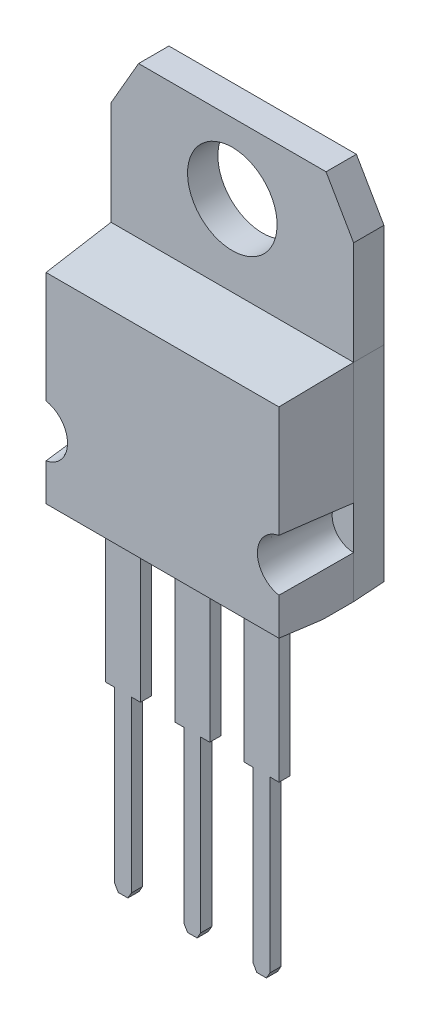
from build123d import *
from OCP.BRepFilletAPI import BRepFilletAPI_MakeChamfer

# Parameters (mm, degrees)
SKIZZE1_W                                 = 10.16
SKIZZE1_H                                 = 8.765
SKIZZE1_H_2                               = 6.335
SKIZZE1_R                                 = 1.875
AUFSATZ_LINEAR_AUSTRAGEN1_DEPTH           = 4.195
SCHNITT_LINEAR_AUSTRAGEN1_DEPTH           = 14.821249039
SCHNITT_LINEAR_AUSTRAGEN1_DEPTH_BACK      = 14.821249039
SCHNITT_LINEAR_AUSTRAGEN2_DEPTH           = 14.821249039
SCHNITT_LINEAR_AUSTRAGEN2_DEPTH_BACK      = 14.821249039
AUFSATZ_LINEAR_AUSTRAGEN2_DEPTH           = 0.47
SKIZZE6_R                                 = 0.9
SCHNITT_LINEAR_AUSTRAGEN3_DEPTH           = 27.52093984
SCHNITT_LINEAR_AUSTRAGEN3_DRAFT           = -4
SCHNITT_LINEAR_AUSTRAGEN3_PROFILE_2_DEPTH = 27.52093984
SCHNITT_LINEAR_AUSTRAGEN3_PROFILE_2_DRAFT = -4
FASE1_SIZE                                = 2
FASE1_SIZE2                               = 1.154700538


with BuildPart() as part:
    # Skizze1 → Aufsatz-Linear austragen1 (new body)
    # profile 1 of 2: a face of its own
    with BuildSketch(Plane.XY):
        with Locations((0, -7.7675)):
            Rectangle(SKIZZE1_W, SKIZZE1_H)
    # profile 2 of 2: a face of its own
    with BuildSketch(Plane.XY):
        with Locations((0, -0.2175)):
            Rectangle(SKIZZE1_W, SKIZZE1_H_2)
        Circle(SKIZZE1_R, mode=Mode.SUBTRACT)
    extrude(amount=AUFSATZ_LINEAR_AUSTRAGEN1_DEPTH)

    # Skizze3 → Schnitt-Linear austragen1 (cut, two sides: drawn at the far end of the back side and taken through both)
    with BuildSketch(Plane(origin=(0, 0, 0), x_dir=(0, 0, -1), z_dir=(1, 0, 0)).offset(-SCHNITT_LINEAR_AUSTRAGEN1_DEPTH_BACK)):
        Polygon((-1.27, 43.960404594), (-1.27, 2.95), (-1.27, -3.385), (-4.195, -3.640904341), (-4.195, -12.029725883), (-2.475, -12.15), (0, -11.97693114), (40.91050531, -9.116189929), (-23.302349016, -60.146793289), (-65.482854325, -7.070198766), align=None)
    extrude(amount=SCHNITT_LINEAR_AUSTRAGEN1_DEPTH + SCHNITT_LINEAR_AUSTRAGEN1_DEPTH_BACK, mode=Mode.SUBTRACT)

    # Skizze4 → Schnitt-Linear austragen2 (cut, two sides: drawn at the far end of the back side and taken through both)
    with BuildSketch(Plane(origin=(0, 0, 0), x_dir=(1, 0, 0), z_dir=(0, 1, 0)).offset(-SCHNITT_LINEAR_AUSTRAGEN2_DEPTH_BACK)):
        Polygon((-7.252588261, 29.799459635), (-5.08, -1.27), (-4.875464075, -4.195), (4.875464075, -4.195), (5.08, -1.27), (7.252588261, 29.799459635), (7.252588261, -32.491196543), (-7.252588261, -32.491196543), align=None)
    extrude(amount=SCHNITT_LINEAR_AUSTRAGEN2_DEPTH + SCHNITT_LINEAR_AUSTRAGEN2_DEPTH_BACK, mode=Mode.SUBTRACT)

    # Skizze5 → Aufsatz-Linear austragen2 (add)
    with BuildSketch(Plane.XY.offset(2.475)):
        Polygon((-3.63, -11.15), (-3.63, -18.5), (-3.25, -18.5), (-3.25, -25.605192379), (-3.1, -25.865), (-2.7, -25.865), (-2.55, -25.605192379), (-2.55, -18.5), (-2.17, -18.5), (-2.17, -11.15), align=None)
        Polygon((-0.73, -11.15), (-0.73, -18.5), (-0.35, -18.5), (-0.35, -25.605192379), (-0.2, -25.865), (0.2, -25.865), (0.35, -25.605192379), (0.35, -18.5), (0.73, -18.5), (0.73, -11.15), align=None)
        Polygon((2.17, -11.15), (2.17, -18.5), (2.55, -18.5), (2.55, -25.605192379), (2.7, -25.865), (3.1, -25.865), (3.25, -25.605192379), (3.25, -18.5), (3.63, -18.5), (3.63, -11.15), align=None)
    extrude(amount=AUFSATZ_LINEAR_AUSTRAGEN2_DEPTH)


with BuildPart() as schnitt_linear_austragen3_tool:
    # Skizze6 → Schnitt-Linear austragen3 (with draft: the straight prism first)
    with BuildSketch(Plane.XY.offset(1.27)):
        with Locations((-5.08, -9.385)):
            Circle(SKIZZE6_R)
    extrude(amount=SCHNITT_LINEAR_AUSTRAGEN3_DEPTH)
    # Schnitt-Linear austragen3: the draft: its side faces are tilted about the plane it starts from
    schnitt_linear_austragen3_sides = [schnitt_linear_austragen3_tool.faces().sort_by_distance(p)[0] for p in [
        (-5.98, -9.385, 15.03046992),
    ]]
    draft(schnitt_linear_austragen3_sides, Plane.XY.offset(1.27), SCHNITT_LINEAR_AUSTRAGEN3_DRAFT)


with BuildPart() as part_1:
    add(part.part)

    # Schnitt-Linear austragen3: cut by schnitt_linear_austragen3_tool
    add(schnitt_linear_austragen3_tool.part, mode=Mode.SUBTRACT)


with BuildPart() as schnitt_linear_austragen3_profile_2_tool:
    # Skizze6 → Schnitt-Linear austragen3 profile 2 (with draft: the straight prism first)
    with BuildSketch(Plane.XY.offset(1.27)):
        with Locations((5.08, -9.385)):
            Circle(SKIZZE6_R)
    extrude(amount=SCHNITT_LINEAR_AUSTRAGEN3_PROFILE_2_DEPTH)
    # Schnitt-Linear austragen3 profile 2: the draft: its side faces are tilted about the plane it starts from
    schnitt_linear_austragen3_profile_2_sides = [schnitt_linear_austragen3_profile_2_tool.faces().sort_by_distance(p)[0] for p in [
        (4.18, -9.385, 15.03046992),
    ]]
    draft(schnitt_linear_austragen3_profile_2_sides, Plane.XY.offset(1.27), SCHNITT_LINEAR_AUSTRAGEN3_PROFILE_2_DRAFT)


with BuildPart() as part_2:
    add(part_1.part)

    # Schnitt-Linear austragen3 profile 2: cut by schnitt_linear_austragen3_profile_2_tool
    add(schnitt_linear_austragen3_profile_2_tool.part, mode=Mode.SUBTRACT)

    # Fase1: one chamfer whose edges measure the first distance from different faces: ONE call of the kernel's chamfer builder (chamfer() names one face for all edges)
    fase1_edges_1 = [part_2.edges().sort_by_distance(p)[0] for p in [
        (-5.08, 2.95, 0.635),
    ]]
    fase1_side_1 = [part_2.faces().sort_by_distance(p)[0] for p in [
        (-5.08, -4.535689282, 0.635627783),
    ]]
    fase1_edges_2 = [part_2.edges().sort_by_distance(p)[0] for p in [
        (5.08, 2.95, 0.635),
    ]]
    fase1_side_2 = [part_2.faces().sort_by_distance(p)[0] for p in [
        (5.08, -4.535689282, 0.635627783),
    ]]
    fase1 = BRepFilletAPI_MakeChamfer(part_2.part.solid().wrapped)
    for e in fase1_edges_1:
        fase1.Add(FASE1_SIZE, FASE1_SIZE2, e.wrapped, fase1_side_1[0].wrapped)  # the first distance lies on this face
    for e in fase1_edges_2:
        fase1.Add(FASE1_SIZE, FASE1_SIZE2, e.wrapped, fase1_side_2[0].wrapped)  # the first distance lies on this face
    add(Compound.cast(fase1.Shape()), mode=Mode.REPLACE)


solid = part_2.part
